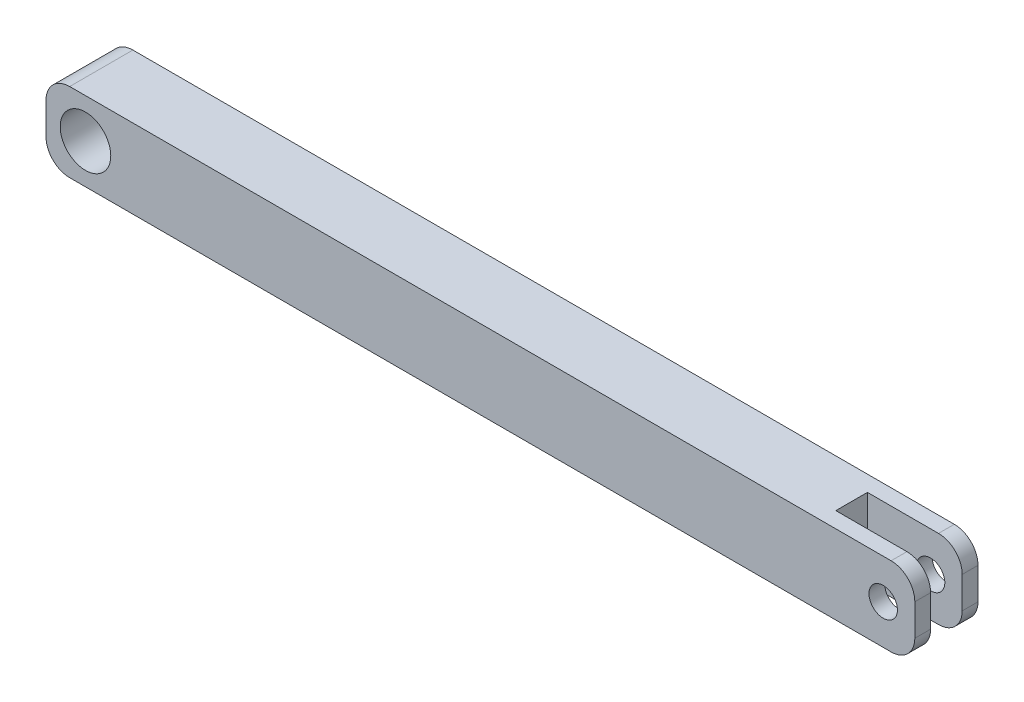
from build123d import *

# Parameters (mm, degrees)
SKETCH_5_W          = 55
SKETCH_5_H          = 3
EXTRUDE_1_DEPTH     = 5
CUT_EXTRUDE_1_REACH = 57.308
SKETCH_6_R          = 1.6
CUT_EXTRUDE_2_REACH = 57.308
SKETCH_7_R          = 0.9
FILLET_1_R          = 1.5
SKETCH_8_W          = 6
SKETCH_8_H          = 1.6
CUT_EXTRUDE_3_DEPTH = 10
SKETCH_10_R         = 1.6
SKETCH_10_R_2       = 0.9
EXTRUDE_2_DEPTH     = 0.5
EXTRUDE_START       = 0.5
SKETCH_11_R         = 0.9
SKETCH_11_R_2       = 1.6
EXTRUDE_3_DEPTH     = 0.5
SKETCH_12_W         = 6.953496512
SKETCH_12_H         = 2
CUT_EXTRUDE_4_DEPTH = 10


with BuildPart() as part:
    # 草图5 → 凸台-拉伸1 (new body)
    with BuildSketch(Plane(origin=(0, 0, 0), x_dir=(1, 0, 0), z_dir=(0, 1, 0))):
        with Locations((27.5, -1.5)):
            Rectangle(SKETCH_5_W, SKETCH_5_H)
    extrude(amount=EXTRUDE_1_DEPTH)

    # 草图6 → 切除-拉伸1 (cut, up to next)
    with BuildSketch(Plane.XY.offset(3), mode=Mode.PRIVATE) as cut_extrude_1_sk1:
        with Locations((2.5, 2.5)):
            Circle(SKETCH_6_R)
    cut_extrude_1_tool1 = extrude(cut_extrude_1_sk1.sketch, amount=-CUT_EXTRUDE_1_REACH, mode=Mode.PRIVATE) & part.part
    add(cut_extrude_1_tool1.solids().sort_by_distance((2.5, 2.5, 3))[0], mode=Mode.SUBTRACT)

    # 草图7 → 切除-拉伸2 (cut, up to next)
    with BuildSketch(Plane.XY, mode=Mode.PRIVATE) as cut_extrude_2_sk1:
        with Locations(Location((53, 2.5, 0), (0, 0, 180))):
            Circle(SKETCH_7_R)
    cut_extrude_2_tool1 = extrude(cut_extrude_2_sk1.sketch, amount=CUT_EXTRUDE_2_REACH, mode=Mode.PRIVATE) & part.part
    add(cut_extrude_2_tool1.solids().sort_by_distance((53, 2.5, 0))[0], mode=Mode.SUBTRACT)

    # 圆角1
    fillet_1_edges = [part.edges().sort_by_distance(p)[0] for p in [
        (55, 5, 1.5),
        (55, 0, 1.5),
        (0, 0, 1.5),
        (0, 5, 1.5),
    ]]
    fillet(fillet_1_edges, radius=FILLET_1_R)

    # 草图8 → 切除-拉伸3 (cut)
    with BuildSketch(Plane(origin=(0, 5, 0), x_dir=(1, 0, 0), z_dir=(0, 1, 0))):
        with Locations((52, -1.5)):
            Rectangle(SKETCH_8_W, SKETCH_8_H)
    extrude(amount=-CUT_EXTRUDE_3_DEPTH, mode=Mode.SUBTRACT)

    # 草图10 → 凸台-拉伸2 (add)
    with BuildSketch(Plane.XY.offset(3)):
        with BuildLine():
            Line((0, 3.5), (0, 1.5))
            ThreePointArc((0, 1.5), (0.439339828, 0.439339828), (1.5, 0))
            Line((1.5, 0), (53.5, 0))
            ThreePointArc((53.5, 0), (54.560660172, 0.439339828), (55, 1.5))
            Line((55, 1.5), (55, 3.5))
            ThreePointArc((55, 3.5), (54.560660172, 4.560660172), (53.5, 5))
            Line((53.5, 5), (1.5, 5))
            ThreePointArc((1.5, 5), (0.439339828, 4.560660172), (0, 3.5))
        make_face()
        with Locations((2.5, 2.5)):
            Circle(SKETCH_10_R, mode=Mode.SUBTRACT)
        with Locations((53, 2.5)):
            Circle(SKETCH_10_R_2, mode=Mode.SUBTRACT)
    extrude(amount=EXTRUDE_2_DEPTH)

    # 草图11 → 凸台-拉伸3 (add)
    with BuildSketch(Plane(origin=(0, 0, 0), x_dir=(-1, 0, 0), z_dir=(0, 0, -1)).offset(EXTRUDE_START)):
        with BuildLine():
            Line((-1.5, 5), (-53.5, 5))
            ThreePointArc((-53.5, 5), (-54.560660172, 4.560660172), (-55, 3.5))
            Line((-55, 3.5), (-55, 1.5))
            ThreePointArc((-55, 1.5), (-54.560660172, 0.439339828), (-53.5, 0))
            Line((-53.5, 0), (-1.5, 0))
            ThreePointArc((-1.5, 0), (-0.439339828, 0.439339828), (0, 1.5))
            Line((0, 1.5), (0, 3.5))
            ThreePointArc((0, 3.5), (-0.439339828, 4.560660172), (-1.5, 5))
        make_face()
        with Locations(Location((-53, 2.5, 0), (0, 0, 180))):
            Circle(SKETCH_11_R, mode=Mode.SUBTRACT)
        with Locations(Location((-2.5, 2.5, 0), (0, 0, 180))):
            Circle(SKETCH_11_R_2, mode=Mode.SUBTRACT)
    extrude(amount=-EXTRUDE_3_DEPTH)

    # 草图12 → 切除-拉伸4 (cut)
    with BuildSketch(Plane(origin=(0, 5, 0), x_dir=(1, 0, 0), z_dir=(0, 1, 0))):
        with Locations((52.476748256, -1.5)):
            Rectangle(SKETCH_12_W, SKETCH_12_H)
    extrude(amount=-CUT_EXTRUDE_4_DEPTH, mode=Mode.SUBTRACT)


solid = part.part
